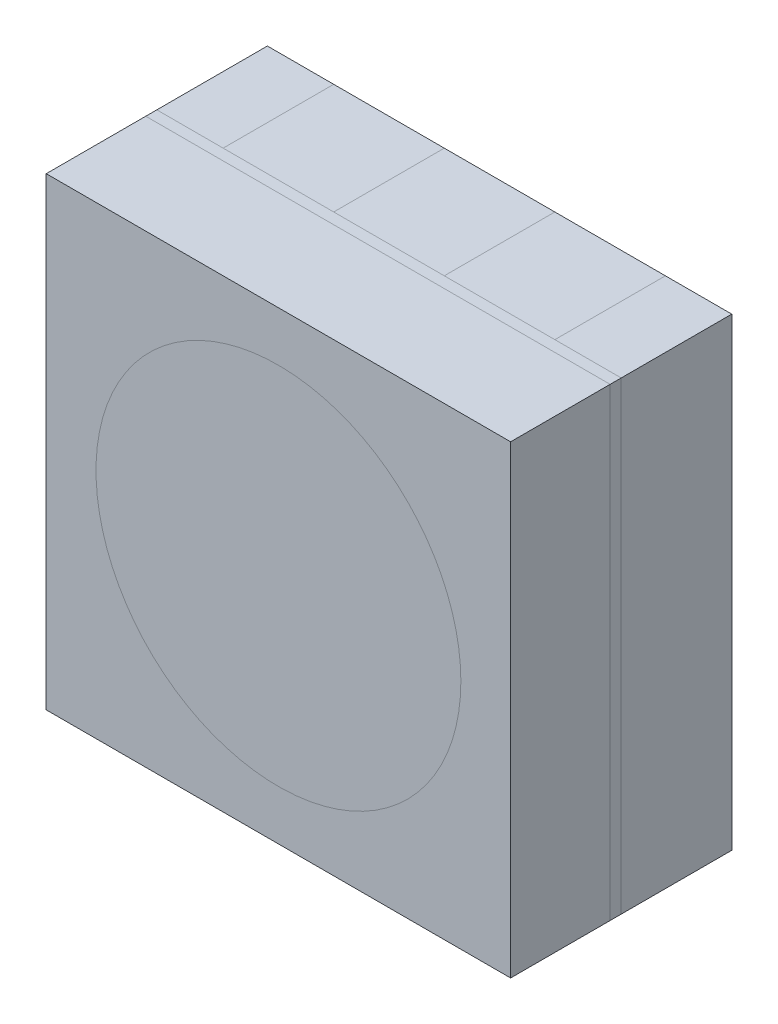
from build123d import *

# Parameters (mm, degrees)
SKETCH1_W             = 2.1
SKETCH1_H             = 2.1
BOSS_EXTRUDE1_DEPTH   = 0.45
SKETCH2_W             = 2.1
SKETCH2_H             = 2.1
BOSS_EXTRUDE2_DEPTH   = 0.05
SKETCH3_W             = 0.5
SKETCH3_H             = 0.5
BOSS_EXTRUDE3_DEPTH   = 0.5
BOSS_EXTRUDE3_2_DEPTH = 0.5
BOSS_EXTRUDE3_3_DEPTH = 0.5
BOSS_EXTRUDE3_4_DEPTH = 0.5
BOSS_EXTRUDE5_DEPTH   = 0.5
SKETCH5_R             = 0.825
CUT_EXTRUDE1_DEPTH    = 0.45
SKETCH6_W             = 0.2
SKETCH6_H             = 0.2
BOSS_EXTRUDE6_DEPTH   = 0.25
BOSS_EXTRUDE6_2_DEPTH = 0.25
BOSS_EXTRUDE6_3_DEPTH = 0.25
SKETCH7_R             = 0.825
BOSS_EXTRUDE7_DEPTH   = 0.1


with BuildPart() as part:
    # Sketch1 → Boss-Extrude1 (new body)
    with BuildSketch(Plane.XY):
        with Locations((1.05, 1.05)):
            Rectangle(SKETCH1_W, SKETCH1_H)
    extrude(amount=BOSS_EXTRUDE1_DEPTH)

    # Sketch5 → Cut-Extrude1 (cut)
    with BuildSketch(Plane.XY.offset(0.45)):
        with Locations((1.05, 1.05)):
            Circle(SKETCH5_R)
    extrude(amount=-CUT_EXTRUDE1_DEPTH, mode=Mode.SUBTRACT)


with BuildPart() as body_2:
    # Sketch2 → Boss-Extrude2 (new body)
    with BuildSketch(Plane(origin=(0, 0, 0), x_dir=(-1, 0, 0), z_dir=(0, 0, -1))):
        with Locations((-1.05, 1.05)):
            Rectangle(SKETCH2_W, SKETCH2_H)
    extrude(amount=BOSS_EXTRUDE2_DEPTH)


with BuildPart() as body_3:
    # Sketch3 → Boss-Extrude3 (new body)
    with BuildSketch(Plane(origin=(0, 0, -0.05), x_dir=(-1, 0, 0), z_dir=(0, 0, -1))):
        with Locations((-0.55, 1.85)):
            Rectangle(SKETCH3_W, SKETCH3_H)
    extrude(amount=BOSS_EXTRUDE3_DEPTH)


with BuildPart() as body_4:
    # Sketch3 → Boss-Extrude3 2 (new body)
    with BuildSketch(Plane(origin=(0, 0, -0.05), x_dir=(-1, 0, 0), z_dir=(0, 0, -1))):
        with Locations((-1.55, 1.85)):
            Rectangle(SKETCH3_W, SKETCH3_H)
    extrude(amount=BOSS_EXTRUDE3_2_DEPTH)


with BuildPart() as body_5:
    # Sketch3 → Boss-Extrude3 3 (new body)
    with BuildSketch(Plane(origin=(0, 0, -0.05), x_dir=(-1, 0, 0), z_dir=(0, 0, -1))):
        with Locations((-1.55, 0.25)):
            Rectangle(SKETCH3_W, SKETCH3_H)
    extrude(amount=BOSS_EXTRUDE3_3_DEPTH)


with BuildPart() as body_6:
    # Sketch3 → Boss-Extrude3 4 (new body)
    with BuildSketch(Plane(origin=(0, 0, -0.05), x_dir=(-1, 0, 0), z_dir=(0, 0, -1))):
        with Locations((-0.55, 0.25)):
            Rectangle(SKETCH3_W, SKETCH3_H)
    extrude(amount=BOSS_EXTRUDE3_4_DEPTH)


with BuildPart() as body_7:
    # Sketch4 → Boss-Extrude5 (new body)
    with BuildSketch(Plane(origin=(0, 0, -0.05), x_dir=(-1, 0, 0), z_dir=(0, 0, -1))):
        Polygon((-2.1, 2.1), (-2.1, 0), (-1.8, 0), (-1.8, 0.5), (-1.3, 0.5), (-1.3, 0), (-0.8, 0), (-0.8, 0.5), (-0.3, 0.5), (-0.3, 0), (0, 0), (0, 2.1), (-0.3, 2.1), (-0.3, 1.6), (-0.8, 1.6), (-0.8, 2.1), (-1.3, 2.1), (-1.3, 1.6), (-1.8, 1.6), (-1.8, 2.1), align=None)
    extrude(amount=BOSS_EXTRUDE5_DEPTH)


with BuildPart() as body_8:
    # Sketch6 → Boss-Extrude6 (new body)
    with BuildSketch(Plane.XY):
        with Locations((1.05, 1.5)):
            Rectangle(SKETCH6_W, SKETCH6_H)
    extrude(amount=BOSS_EXTRUDE6_DEPTH)


with BuildPart() as body_9:
    # Sketch6 → Boss-Extrude6 2 (new body)
    with BuildSketch(Plane.XY):
        with Locations((1.05, 1.05)):
            Rectangle(SKETCH6_W, SKETCH6_H)
    extrude(amount=BOSS_EXTRUDE6_2_DEPTH)


with BuildPart() as body_10:
    # Sketch6 → Boss-Extrude6 3 (new body)
    with BuildSketch(Plane.XY):
        with Locations((1.05, 0.6)):
            Rectangle(SKETCH6_W, SKETCH6_H)
    extrude(amount=BOSS_EXTRUDE6_3_DEPTH)


with BuildPart() as body_11:
    # Sketch7 → Boss-Extrude7 (new body)
    with BuildSketch(Plane.XY.offset(0.45)):
        with Locations((1.05, 1.05)):
            Circle(SKETCH7_R)
    extrude(amount=-BOSS_EXTRUDE7_DEPTH)


solid = Compound([part.part, body_2.part, body_3.part, body_4.part, body_5.part, body_6.part, body_7.part, body_8.part, body_9.part, body_10.part, body_11.part])
